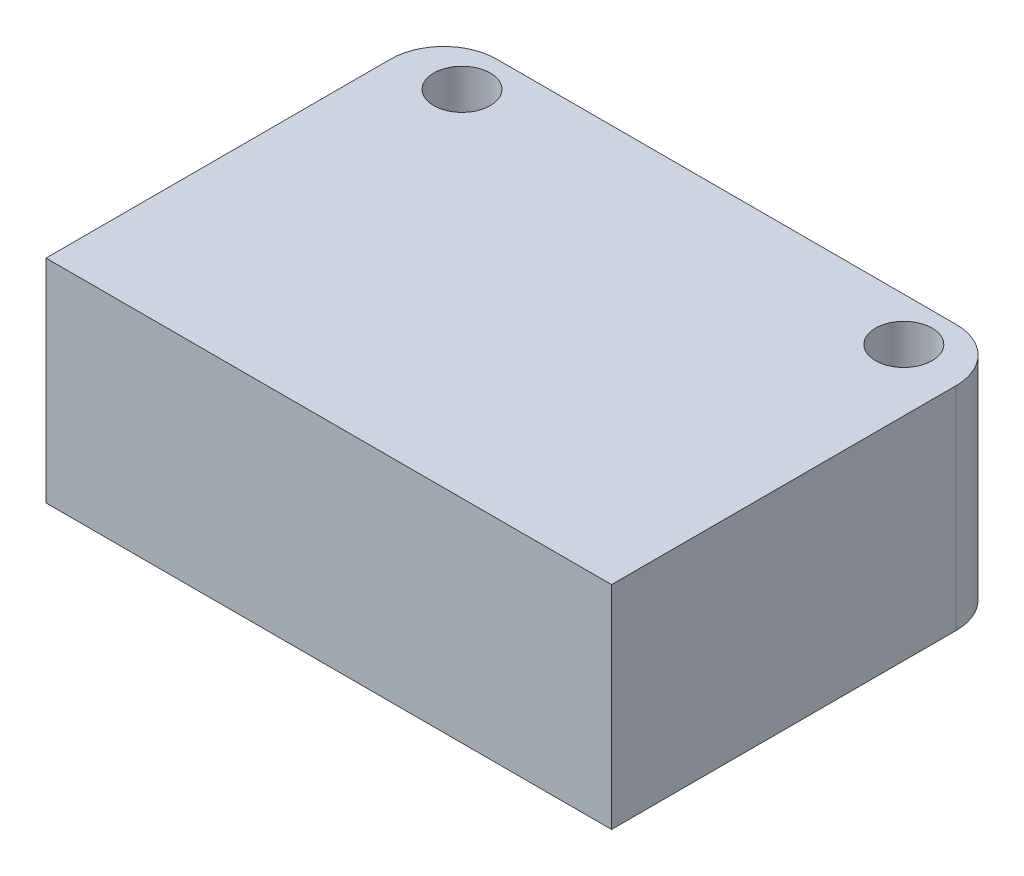
from build123d import *

# Parameters (mm, degrees)
SKETCH_1_R      = 1.6
EXTRUDE_1_DEPTH = 6
SKETCH_2_R      = 4
EXTRUDE_2_DEPTH = 2
FILLET_1_R      = 1


with BuildPart() as part:
    # 草图1 → 凸台-拉伸1 (new, symmetric)
    with BuildSketch(Plane(origin=(0, 0, 0), x_dir=(1, 0, 0), z_dir=(0, 1, 0))):
        with BuildLine():
            Line((-16, -11.25), (16, -11.25))
            Line((16, -11.25), (16, 8.25))
            ThreePointArc((16, 8.25), (15.121320344, 10.371320344), (13, 11.25))
            Line((13, 11.25), (-13, 11.25))
            ThreePointArc((-13, 11.25), (-15.121320344, 10.371320344), (-16, 8.25))
            Line((-16, 8.25), (-16, -11.25))
        make_face()
        with Locations(Location((12.5, 8.7890625, 0), (0, 0, 270))):
            Circle(SKETCH_1_R, mode=Mode.SUBTRACT)
        with Locations(Location((-12.5, 8.7890625, 0), (0, 0, 90))):
            Circle(SKETCH_1_R, mode=Mode.SUBTRACT)
    extrude(amount=EXTRUDE_1_DEPTH, both=True)

    # 草图2 → 凸台-拉伸2 (add)
    with BuildSketch(Plane.ZY.offset(16)):
        with Locations(Location((-4.25, 0, 0), (0, 0, 180))):
            Circle(SKETCH_2_R)
    extrude(amount=EXTRUDE_2_DEPTH)

    # 圆角1
    fillet_1_edges = [part.edges().sort_by_distance(p)[0] for p in [
        (-16, 0, -0.25),
    ]]
    fillet(fillet_1_edges, radius=FILLET_1_R)


solid = part.part
